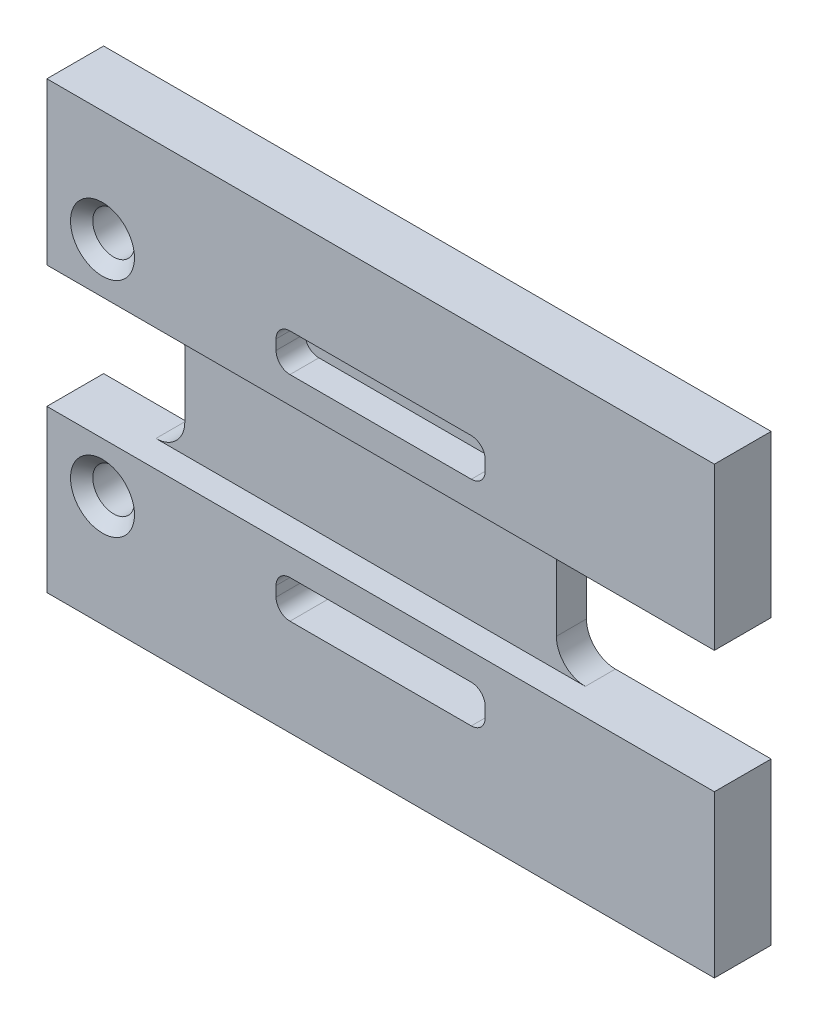
from build123d import *

# Parameters (mm, degrees)
SKETCH1_W           = 50.8
SKETCH1_H           = 76.2
BOSS_EXTRUDE1_DEPTH = 6.477
SKETCH3_W           = 76.2
SKETCH3_H           = 13.97
CUT_EXTRUDE2_DEPTH  = 3.048
SKETCH2_R           = 2.38125
SKETCH2_W           = 12.7
SKETCH2_H           = 13.97
SKETCH2_W_2         = 21.082
CUT_EXTRUDE1_DEPTH  = 47.24631368
FILLET1_R           = 3.302
SKETCH5_W           = 23.876
SKETCH5_H           = 3.302
CUT_EXTRUDE3_DEPTH  = 47.24631368
SKETCH6_W           = 23.876
SKETCH6_H           = 1.016
CUT_EXTRUDE4_DEPTH  = 3.302
FILLET4_R           = 1.5875
FILLET5_R           = 1.5875
CHAMFER1_SIZE       = 1.27


with BuildPart() as part:
    # Sketch1 → Boss-Extrude1 (new body)
    with BuildSketch(Plane(origin=(0, 0, 0), x_dir=(0, 1, 0), z_dir=(0, 0, 1))):
        Rectangle(SKETCH1_W, SKETCH1_H)
    extrude(amount=BOSS_EXTRUDE1_DEPTH)

    # Sketch3 → Cut-Extrude2 (cut)
    with BuildSketch(Plane.XY.offset(6.477)):
        Rectangle(SKETCH3_W, SKETCH3_H)
    extrude(amount=-CUT_EXTRUDE2_DEPTH, mode=Mode.SUBTRACT)

    # Sketch2 → Cut-Extrude1 (cut, through all)
    with BuildSketch(Plane.XY.offset(6.477)):
        with Locations((-31.75, 12.7)):
            Circle(SKETCH2_R)
        with Locations((-31.75, -12.7)):
            Circle(SKETCH2_R)
        with Locations((-31.75, 0)):
            Rectangle(SKETCH2_W, SKETCH2_H)
        with Locations((27.559, 0)):
            Rectangle(SKETCH2_W_2, SKETCH2_H)
    extrude(amount=-CUT_EXTRUDE1_DEPTH, mode=Mode.SUBTRACT)

    # Fillet1
    fillet1_edges = [part.edges().sort_by_distance(p)[0] for p in [
        (-25.4, 6.985, 1.7145),
        (-25.4, -6.985, 1.7145),
        (17.018, 6.985, 1.7145),
        (17.018, -6.985, 1.7145),
    ]]
    fillet(fillet1_edges, radius=FILLET1_R)

    # Sketch5 → Cut-Extrude3 (cut, through all)
    with BuildSketch(Plane.XY.offset(6.477)):
        with Locations((0, 12.7)):
            Rectangle(SKETCH5_W, SKETCH5_H)
    cut_extrude3 = extrude(amount=-CUT_EXTRUDE3_DEPTH, mode=Mode.SUBTRACT)

    # Sketch6 → Cut-Extrude4 (cut)
    with BuildSketch(Plane.XY.offset(6.477)):
        with Locations((0, 10.541)):
            Rectangle(SKETCH6_W, SKETCH6_H)
    cut_extrude4 = extrude(amount=-CUT_EXTRUDE4_DEPTH, mode=Mode.SUBTRACT)

    # Mirror1: Cut-Extrude3, Cut-Extrude4 across plane
    add(cut_extrude3.mirror(Plane.ZX), mode=Mode.SUBTRACT)
    add(cut_extrude4.mirror(Plane.ZX), mode=Mode.SUBTRACT)

    # Fillet4
    fillet4_edges = [part.edges().sort_by_distance(p)[0] for p in [
        (11.938, 14.351, 3.2385),
        (11.938, 11.049, 1.5875),
        (-11.938, 11.049, 1.5875),
        (-11.938, 14.351, 3.2385),
        (11.938, -11.049, 1.5875),
        (11.938, -14.351, 3.2385),
        (-11.938, -14.351, 3.2385),
        (-11.938, -11.049, 1.5875),
    ]]
    fillet(fillet4_edges, radius=FILLET4_R)

    # Fillet5
    fillet5_edges = [part.edges().sort_by_distance(p)[0] for p in [
        (-11.938, 10.033, 4.826),
        (11.938, 10.033, 4.826),
        (-11.938, -10.033, 4.826),
        (11.938, -10.033, 4.826),
    ]]
    fillet(fillet5_edges, radius=FILLET5_R)

    # Chamfer1
    chamfer1_edges = [part.edges().sort_by_distance(p)[0] for p in [
        (-34.13125, 12.7, 6.477),
        (-34.13125, -12.7, 6.477),
    ]]
    chamfer(chamfer1_edges, length=CHAMFER1_SIZE)


solid = part.part
